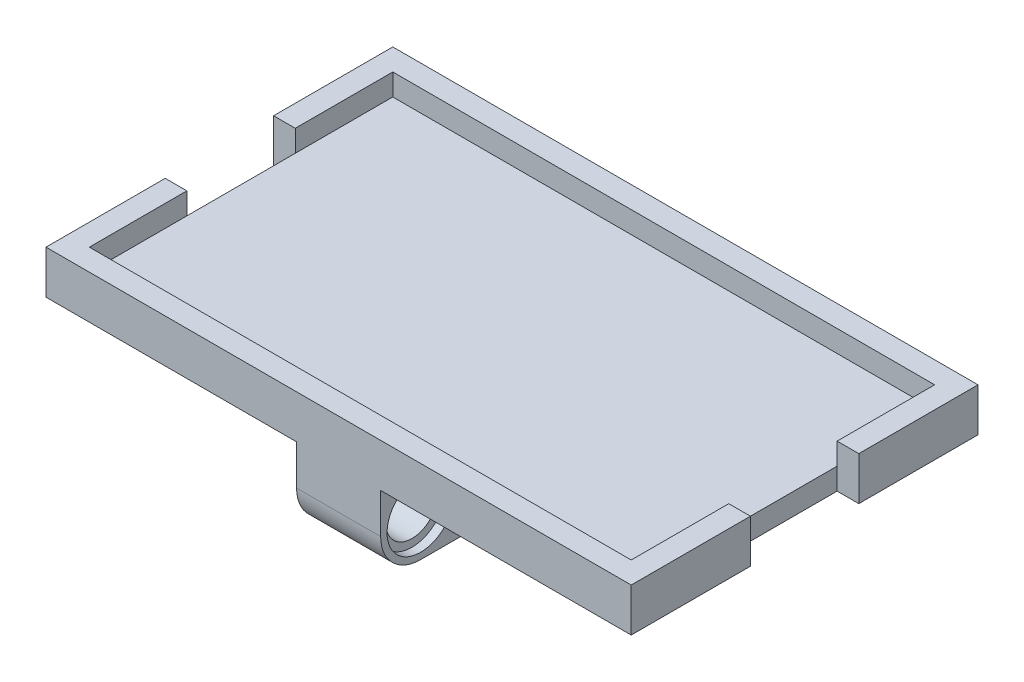
from build123d import *

# Parameters (mm, degrees)
SKETCH1_W           = 54
SKETCH1_H           = 32
BOSS_EXTRUDE1_DEPTH = 2
SKETCH2_W           = 54
SKETCH2_H           = 32
SKETCH2_W_2         = 50
SKETCH2_H_2         = 28
BOSS_EXTRUDE2_DEPTH = 2
SKETCH3_W           = 2
SKETCH3_H           = 10
CUT_EXTRUDE1_DEPTH  = 4
SKETCH4_W           = 7.76
SKETCH4_H           = 23.32
BOSS_EXTRUDE3_DEPTH = 7.38
SKETCH5_R           = 2.4
CUT_EXTRUDE2_DEPTH  = 7.79
SKETCH6_R           = 3.1
CUT_EXTRUDE3_DEPTH  = 0.8
CUT_EXTRUDE4_START  = -0.8
SKETCH7_R           = 3.1
CUT_EXTRUDE4_DEPTH  = 0.8
FILLET1_R           = 3.69


with BuildPart() as part:
    # Sketch1 → Boss-Extrude1 (new body)
    with BuildSketch(Plane(origin=(0, 0, 0), x_dir=(1, 0, 0), z_dir=(0, 1, 0))):
        with Locations((27, 16)):
            Rectangle(SKETCH1_W, SKETCH1_H)
    extrude(amount=BOSS_EXTRUDE1_DEPTH)

    # Sketch2 → Boss-Extrude2 (add)
    with BuildSketch(Plane(origin=(0, 2, 0), x_dir=(1, 0, 0), z_dir=(0, 1, 0))):
        with Locations((27, 16)):
            Rectangle(SKETCH2_W, SKETCH2_H)
        with Locations((27, 16)):
            Rectangle(SKETCH2_W_2, SKETCH2_H_2, mode=Mode.SUBTRACT)
    extrude(amount=BOSS_EXTRUDE2_DEPTH)

    # Sketch3 → Cut-Extrude1 (cut)
    with BuildSketch(Plane(origin=(0, 4, 0), x_dir=(1, 0, 0), z_dir=(0, 1, 0))):
        with Locations((1, 16)):
            Rectangle(SKETCH3_W, SKETCH3_H)
        with Locations((53, 16)):
            Rectangle(SKETCH3_W, SKETCH3_H)
    extrude(amount=-CUT_EXTRUDE1_DEPTH, mode=Mode.SUBTRACT)

    # Sketch4 → Boss-Extrude3 (add)
    with BuildSketch(Plane.XZ):
        with Locations((27, -11.66)):
            Rectangle(SKETCH4_W, SKETCH4_H)
    extrude(amount=BOSS_EXTRUDE3_DEPTH)

    # Sketch5 → Cut-Extrude2 (cut)
    with BuildSketch(Plane(origin=(30.88, 0, 0), x_dir=(0, 0, -1), z_dir=(1, 0, 0))):
        with Locations((3.69, -3.69)):
            Circle(SKETCH5_R)
        with Locations((11.66, -3.69)):
            Circle(SKETCH5_R)
        with Locations((19.63, -3.69)):
            Circle(SKETCH5_R)
    extrude(amount=-CUT_EXTRUDE2_DEPTH, mode=Mode.SUBTRACT)

    # Sketch6 → Cut-Extrude3 (cut)
    with BuildSketch(Plane.ZY.offset(-23.12)):
        with Locations((-11.66, -3.69)):
            Circle(SKETCH6_R)
        with Locations((-3.69, -3.69)):
            Circle(SKETCH6_R)
        with Locations((-19.63, -3.69)):
            Circle(SKETCH6_R)
    extrude(amount=-CUT_EXTRUDE3_DEPTH, mode=Mode.SUBTRACT)

    # Sketch7 → Cut-Extrude4 (cut)
    with BuildSketch(Plane(origin=(30.88, 0, 0), x_dir=(0, 0, -1), z_dir=(1, 0, 0)).offset(CUT_EXTRUDE4_START)):
        with Locations(Location((3.69, -3.69, 0), (0, 0, 180))):
            Circle(SKETCH7_R)
        with Locations(Location((11.66, -3.69, 0), (0, 0, 180))):
            Circle(SKETCH7_R)
        with Locations(Location((19.63, -3.69, 0), (0, 0, 180))):
            Circle(SKETCH7_R)
    extrude(amount=CUT_EXTRUDE4_DEPTH, mode=Mode.SUBTRACT)

    # Fillet1
    fillet1_edges = [part.edges().sort_by_distance(p)[0] for p in [
        (27, -7.38, -23.32),
        (27, -7.38, 0),
    ]]
    fillet(fillet1_edges, radius=FILLET1_R)


solid = part.part
